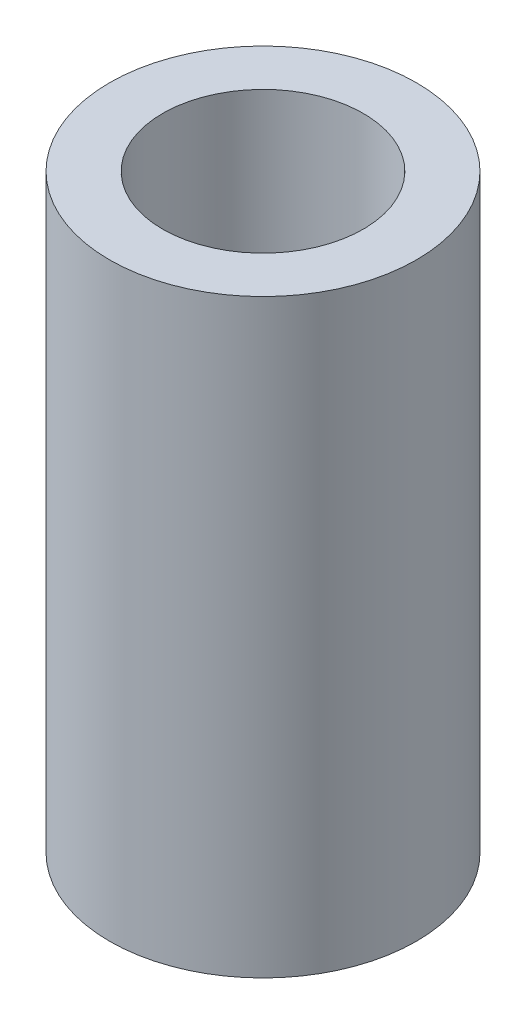
from build123d import *

# Parameters (mm, degrees)
SKETCH_1_R      = 6.5
SKETCH_1_R_2    = 4.25
EXTRUDE_1_DEPTH = 25


with BuildPart() as part:
    # Эскиз1 → Бобышка-Вытянуть1 (new body)
    with BuildSketch(Plane(origin=(0, 0, 0), x_dir=(1, 0, 0), z_dir=(0, 1, 0))):
        with Locations(Location((0, 0, 0), (0, 0, 270))):
            Circle(SKETCH_1_R)
        with Locations(Location((0, 0, 0), (0, 0, 270))):
            Circle(SKETCH_1_R_2, mode=Mode.SUBTRACT)
    extrude(amount=EXTRUDE_1_DEPTH)


solid = part.part
